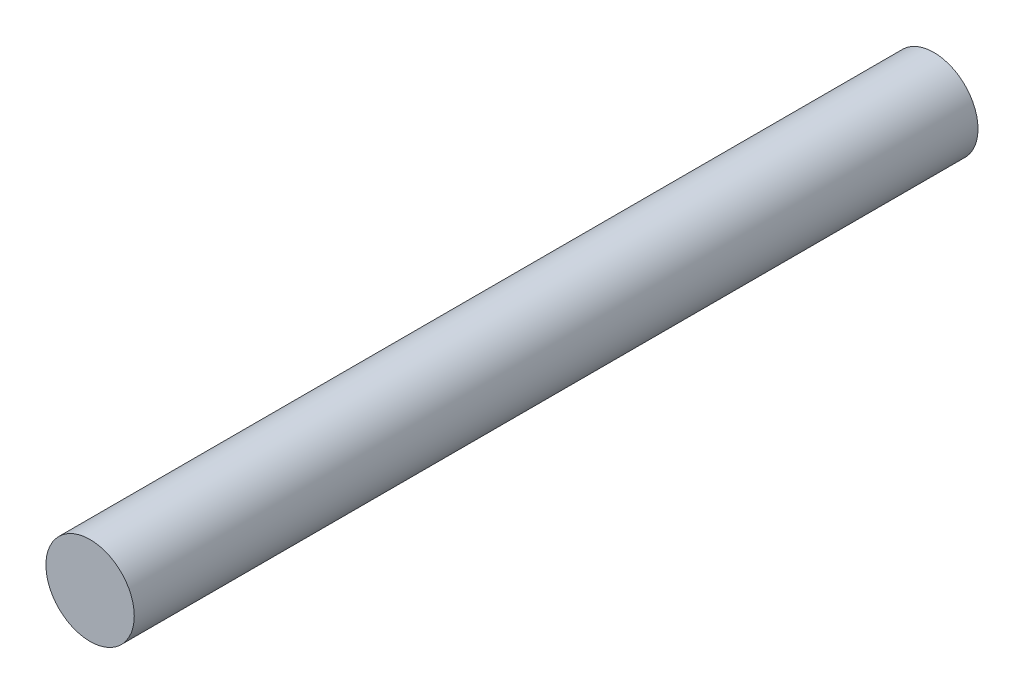
from build123d import *

# Parameters (mm, degrees)
SKETCH1_R           = 5
BOSS_EXTRUDE1_DEPTH = 95.5


with BuildPart() as part:
    # Sketch1 → Boss-Extrude1 (new body)
    with BuildSketch(Plane.XY):
        Circle(SKETCH1_R)
    extrude(amount=-BOSS_EXTRUDE1_DEPTH)


solid = part.part
